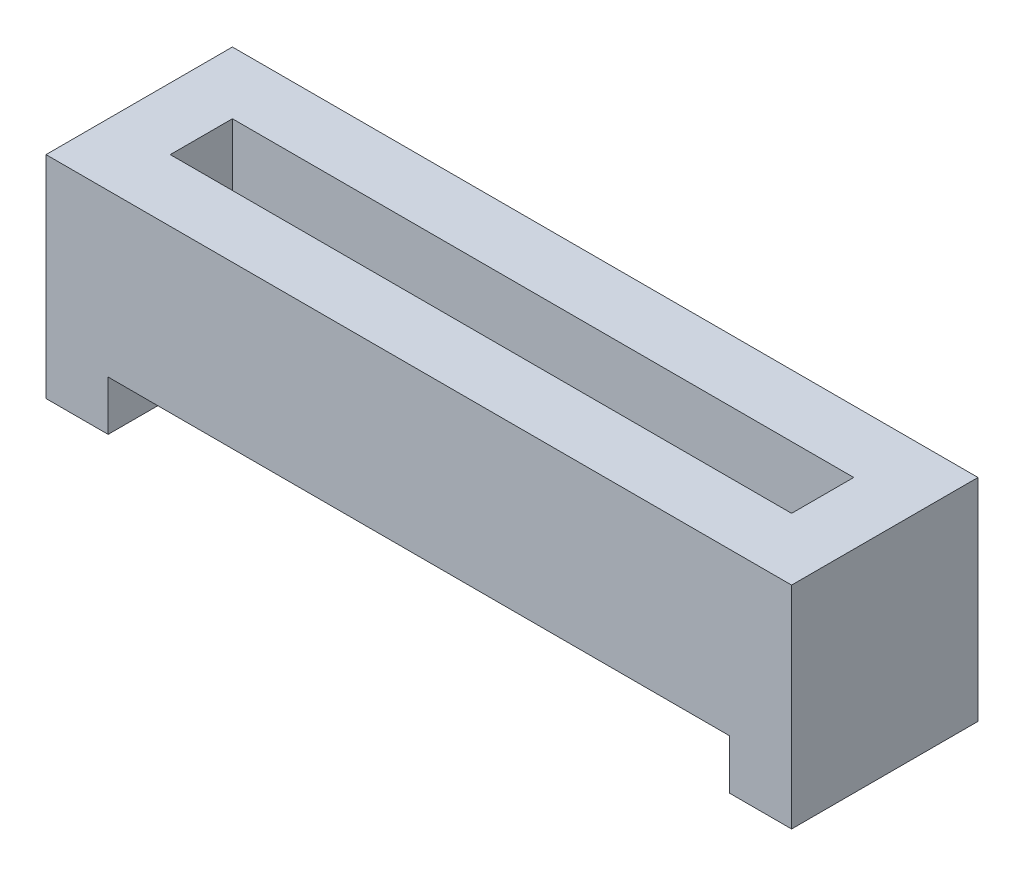
from build123d import *

# Parameters (mm, degrees)
SKETCH1_W           = 60
SKETCH1_H           = 15
BOSS_EXTRUDE1_DEPTH = 13
SKETCH4_W           = 5
SKETCH4_H           = 15
BOSS_EXTRUDE2_DEPTH = 4
SKETCH2_W           = 50
SKETCH2_H           = 5
CUT_EXTRUDE1_DEPTH  = 10


with BuildPart() as part:
    # Sketch1 → Boss-Extrude1 (new body)
    with BuildSketch(Plane(origin=(0, 0, 0), x_dir=(1, 0, 0), z_dir=(0, 1, 0))):
        Rectangle(SKETCH1_W, SKETCH1_H)
    extrude(amount=BOSS_EXTRUDE1_DEPTH)

    # Sketch4 → Boss-Extrude2 (add)
    with BuildSketch(Plane(origin=(0, 0, 0), x_dir=(-1, 0, 0), z_dir=(0, -1, 0))):
        with Locations((27.5, 0)):
            Rectangle(SKETCH4_W, SKETCH4_H)
    boss_extrude2 = extrude(amount=BOSS_EXTRUDE2_DEPTH)

    # Mirror1: Boss-Extrude2 across plane
    add(boss_extrude2.mirror(Plane(origin=(0, 0, 0), x_dir=(0, 0, 1), z_dir=(1, 0, 0))))

    # Sketch2 → Cut-Extrude1 (cut)
    with BuildSketch(Plane(origin=(0, 13, 0), x_dir=(1, 0, 0), z_dir=(0, 1, 0))):
        Rectangle(SKETCH2_W, SKETCH2_H)
    extrude(amount=-CUT_EXTRUDE1_DEPTH, mode=Mode.SUBTRACT)


solid = part.part
